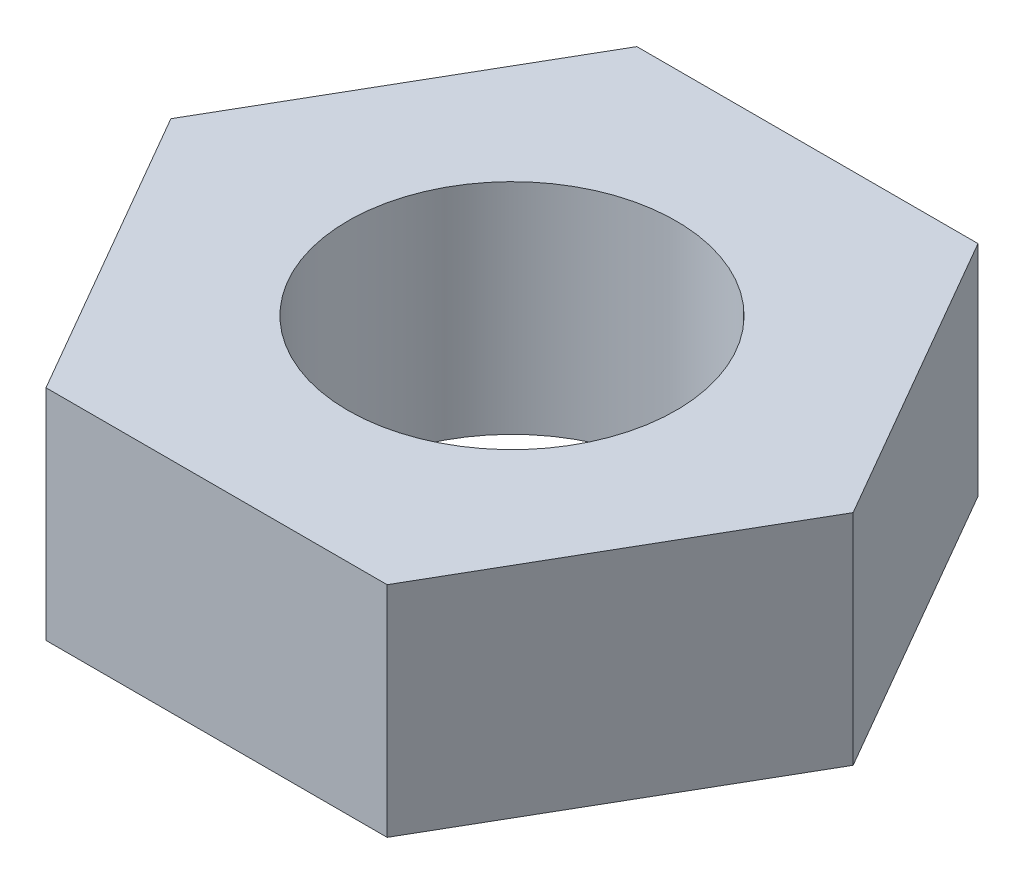
from build123d import *

# Parameters (mm, degrees)
SKETCH1_R           = 1.5
BOSS_EXTRUDE1_DEPTH = 2


with BuildPart() as part:
    # Sketch1 → Boss-Extrude1 (new body)
    with BuildSketch(Plane(origin=(0, 0, 0), x_dir=(1, 0, 0), z_dir=(0, 1, 0))):
        Polygon((-3.117691454, 0), (-1.558845727, -2.7), (1.558845727, -2.7), (3.117691454, 0), (1.558845727, 2.7), (-1.558845727, 2.7), align=None)
        with Locations(Location((0, 0, 0), (0, 0, 270))):
            Circle(SKETCH1_R, mode=Mode.SUBTRACT)
    extrude(amount=BOSS_EXTRUDE1_DEPTH)


solid = part.part
